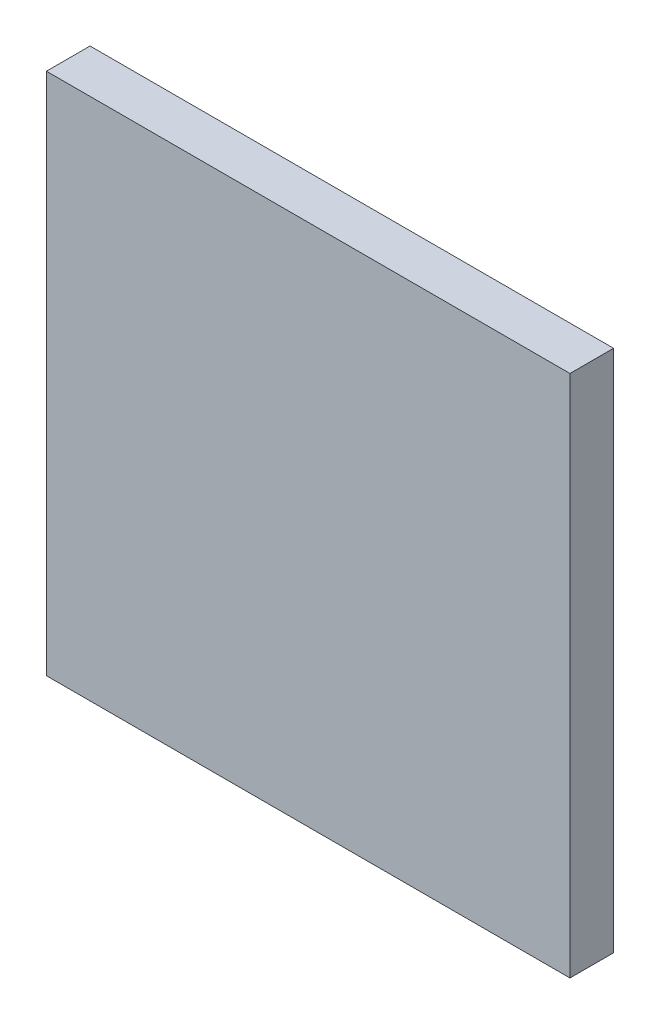
from build123d import *

# Parameters (mm, degrees)
SKETCH1_W           = 152.4
SKETCH1_H           = 152.4
BOSS_EXTRUDE1_DEPTH = 12.7


with BuildPart() as part:
    # Sketch1 → Boss-Extrude1 (new body)
    with BuildSketch(Plane.XY):
        Rectangle(SKETCH1_W, SKETCH1_H)
    extrude(amount=BOSS_EXTRUDE1_DEPTH)


solid = part.part
